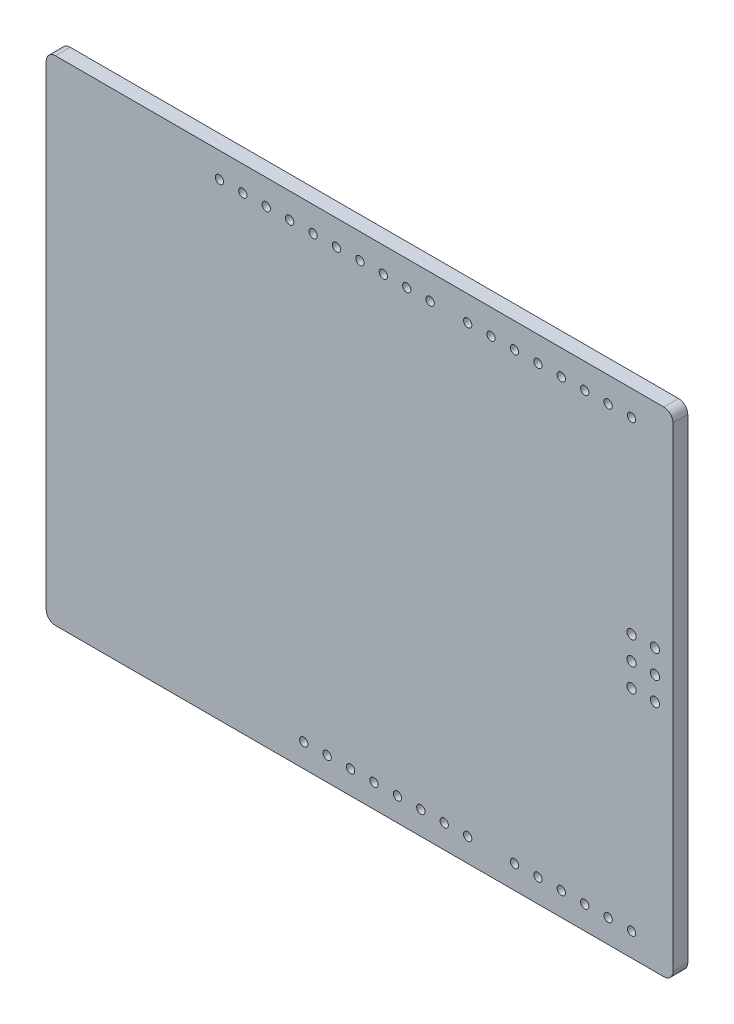
from build123d import *

# Parameters (mm, degrees)
SKIZZE1_W                       = 68
SKIZZE1_H                       = 53.53
AUFSATZ_LINEAR_AUSTRAGEN1_DEPTH = 1.6
SKIZZE2_R                       = 0.45
SKIZZE2_R_2                     = 0.5
SCHNITT_LINEAR_AUSTRAGEN1_DEPTH = 1.6
VERRUNDUNG1_R                   = 1


with BuildPart() as part:
    # Skizze1 → Aufsatz-Linear austragen1 (new body)
    with BuildSketch(Plane.XY):
        with Locations((34, 26.765)):
            Rectangle(SKIZZE1_W, SKIZZE1_H)
    extrude(amount=AUFSATZ_LINEAR_AUSTRAGEN1_DEPTH)

    # Skizze2 → Schnitt-Linear austragen1 (cut)
    with BuildSketch(Plane.XY.offset(1.6)):
        with Locations((45.72, 2.54)):
            Circle(SKIZZE2_R)
        with Locations((63.5, 2.54)):
            Circle(SKIZZE2_R)
        with Locations((63.5, 50.8)):
            Circle(SKIZZE2_R)
        with Locations((41.65, 50.8)):
            Circle(SKIZZE2_R)
        with Locations((43.18, 2.54)):
            Circle(SKIZZE2_R)
        with Locations((40.64, 2.54)):
            Circle(SKIZZE2_R)
        with Locations((38.1, 2.54)):
            Circle(SKIZZE2_R)
        with Locations((35.56, 2.54)):
            Circle(SKIZZE2_R)
        with Locations((33.02, 2.54)):
            Circle(SKIZZE2_R)
        with Locations((60.96, 2.54)):
            Circle(SKIZZE2_R)
        with Locations((58.42, 2.54)):
            Circle(SKIZZE2_R)
        with Locations((55.88, 2.54)):
            Circle(SKIZZE2_R)
        with Locations((53.34, 2.54)):
            Circle(SKIZZE2_R)
        with Locations((50.8, 2.54)):
            Circle(SKIZZE2_R)
        with Locations((30.48, 2.54)):
            Circle(SKIZZE2_R)
        with Locations((27.94, 2.54)):
            Circle(SKIZZE2_R)
        with Locations((39.11, 50.8)):
            Circle(SKIZZE2_R)
        with Locations((36.57, 50.8)):
            Circle(SKIZZE2_R)
        with Locations((34.03, 50.8)):
            Circle(SKIZZE2_R)
        with Locations((31.49, 50.8)):
            Circle(SKIZZE2_R)
        with Locations((28.95, 50.8)):
            Circle(SKIZZE2_R)
        with Locations((26.41, 50.8)):
            Circle(SKIZZE2_R)
        with Locations((23.87, 50.8)):
            Circle(SKIZZE2_R)
        with Locations((21.33, 50.8)):
            Circle(SKIZZE2_R)
        with Locations((18.79, 50.8)):
            Circle(SKIZZE2_R)
        with Locations((60.96, 50.8)):
            Circle(SKIZZE2_R)
        with Locations((58.42, 50.8)):
            Circle(SKIZZE2_R)
        with Locations((55.88, 50.8)):
            Circle(SKIZZE2_R)
        with Locations((53.34, 50.8)):
            Circle(SKIZZE2_R)
        with Locations((50.8, 50.8)):
            Circle(SKIZZE2_R)
        with Locations((48.26, 50.8)):
            Circle(SKIZZE2_R)
        with Locations((45.72, 50.8)):
            Circle(SKIZZE2_R)
        with Locations((63.5, 25.35)):
            Circle(SKIZZE2_R_2)
        with Locations((63.5, 27.89)):
            Circle(SKIZZE2_R_2)
        with Locations((63.5, 30.43)):
            Circle(SKIZZE2_R_2)
        with Locations((66.04, 30.43)):
            Circle(SKIZZE2_R_2)
        with Locations((66.04, 25.35)):
            Circle(SKIZZE2_R_2)
        with Locations((66.04, 27.89)):
            Circle(SKIZZE2_R_2)
    extrude(amount=-SCHNITT_LINEAR_AUSTRAGEN1_DEPTH, mode=Mode.SUBTRACT)

    # Verrundung1
    verrundung1_edges = [part.edges().sort_by_distance(p)[0] for p in [
        (0, 53.53, 0.8),
        (68, 53.53, 0.8),
        (68, 0, 0.8),
        (0, 0, 0.8),
    ]]
    fillet(verrundung1_edges, radius=VERRUNDUNG1_R)


solid = part.part
